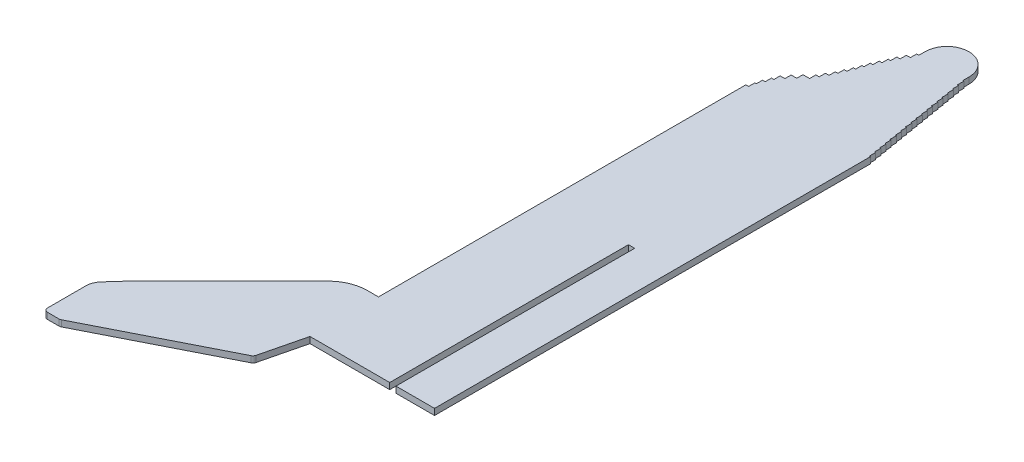
from build123d import *

# Parameters (mm, degrees)
SALIENTE_EXTRUIR1_DEPTH = 3


with BuildPart() as part:
    # Croquis1 → Saliente-Extruir1 (new body)
    with BuildSketch(Plane(origin=(0, 0, 0), x_dir=(1, 0, 0), z_dir=(0, 1, 0))):
        with BuildLine():
            Line((0, 33), (-5.331406318, 33))
            ThreePointArc((-5.331406318, 33), (-12.593971099, 31.555386046), (-18.750876228, 27.441473563))
            Line((-18.750876228, 27.441473563), (-64.799895827, -18.607546035))
            ThreePointArc((-64.799895827, -18.607546035), (-69.135552051, -23.128851505), (-73.277942785, -27.827863853))
            ThreePointArc((-73.277942785, -27.827863853), (-74.646122538, -30.183582463), (-75.121480816, -32.86599938))
            Line((-75.121480816, -32.86599938), (-75.121480816, -51.309071299))
            ThreePointArc((-75.121480816, -51.309071299), (-74.581521028, -52.612649541), (-73.277942785, -53.152609329))
            Line((-73.277942785, -53.152609329), (-67.7929112, -53.152609329))
            ThreePointArc((-67.7929112, -53.152609329), (-67.328497374, -53.097942153), (-66.88947174, -52.936929127))
            Line((-66.88947174, -52.936929127), (-6.151808223, -22.184144776))
            ThreePointArc((-6.151808223, -22.184144776), (-5.489025915, -21.643589172), (-5.112658875, -20.875586177))
            Line((-5.112658875, -20.875586177), (0, 0))
            Line((0, 0), (38.425, 0))
            Line((38.425, 0), (38.425, 115))
            Line((38.425, 115), (41.425, 115))
            Line((41.425, 115), (41.425, 0))
            Line((41.425, 0), (60, 0))
            Line((60, 0), (60, 210))
            Line((60, 210), (59.5, 210))
            Line((59.5, 210), (59.5, 213))
            Line((59.5, 213), (59, 213))
            Line((59, 213), (59, 216))
            Line((59, 216), (58.5, 216))
            Line((58.5, 216), (58.5, 219))
            Line((58.5, 219), (58, 219))
            Line((58, 219), (58, 222))
            Line((58, 222), (57.5, 222))
            Line((57.5, 222), (57.5, 225))
            Line((57.5, 225), (57, 225))
            Line((57, 225), (57, 228))
            Line((57, 228), (56.5, 228))
            Line((56.5, 228), (56.5, 231))
            Line((56.5, 231), (56, 231))
            Line((56, 231), (56, 234))
            Line((56, 234), (55.5, 234))
            Line((55.5, 234), (55.5, 237))
            Line((55.5, 237), (55, 237))
            Line((55, 237), (55, 240))
            Line((55, 240), (54.5, 240))
            Line((54.5, 240), (54.5, 243))
            Line((54.5, 243), (54, 243))
            Line((54, 243), (54, 246))
            Line((54, 246), (53.5, 246))
            Line((53.5, 246), (53.5, 249))
            Line((53.5, 249), (53, 249))
            Line((53, 249), (53, 252))
            Line((53, 252), (52.5, 252))
            Line((52.5, 252), (52.5, 255))
            Line((52.5, 255), (52, 255))
            Line((52, 255), (52, 258))
            Line((52, 258), (51.5, 258))
            Line((51.5, 258), (51.5, 261))
            Line((51.5, 261), (51, 261))
            Line((51, 261), (51, 264))
            Line((51, 264), (50.5, 264))
            Line((50.5, 264), (50.5, 267))
            ThreePointArc((50.5, 267), (39.925, 277.575), (29.35, 267))
            Line((29.35, 267), (29.35, 264))
            Line((29.35, 264), (28.27, 264))
            Line((28.27, 264), (28.27, 261))
            Line((28.27, 261), (26.35, 261))
            Line((26.35, 261), (26.35, 258))
            Line((26.35, 258), (24.78, 258))
            Line((24.78, 258), (24.78, 255))
            Line((24.78, 255), (23.58, 255))
            Line((23.58, 255), (23.58, 252))
            Line((23.58, 252), (22.19, 252))
            Line((22.19, 252), (22.19, 249))
            Line((22.19, 249), (20.92, 249))
            Line((20.92, 249), (20.92, 246))
            Line((20.92, 246), (19.9, 246))
            Line((19.9, 246), (19.9, 243))
            Line((19.9, 243), (18.75, 243))
            Line((18.75, 243), (18.75, 240))
            Line((18.75, 240), (17.37, 240))
            Line((17.37, 240), (17.37, 237))
            Line((17.37, 237), (16.1, 237))
            Line((16.1, 237), (16.1, 234))
            Line((16.1, 234), (14.35, 234))
            Line((14.35, 234), (14.35, 231))
            Line((14.35, 231), (12.73, 231))
            Line((12.73, 231), (12.73, 228))
            Line((12.73, 228), (9.53, 228))
            Line((9.53, 228), (9.53, 225))
            Line((9.53, 225), (6.82, 225))
            Line((6.82, 225), (6.82, 222))
            Line((6.82, 222), (4.53, 222))
            Line((4.53, 222), (4.53, 219))
            Line((4.53, 219), (3.37, 219))
            Line((3.37, 219), (3.37, 216))
            Line((3.37, 216), (2.09, 216))
            Line((2.09, 216), (2.09, 213))
            Line((2.09, 213), (1.36, 213))
            Line((1.36, 213), (1.36, 210))
            Line((1.36, 210), (0, 210))
            Line((0, 210), (0, 33))
        make_face()
    extrude(amount=SALIENTE_EXTRUIR1_DEPTH)


solid = part.part
